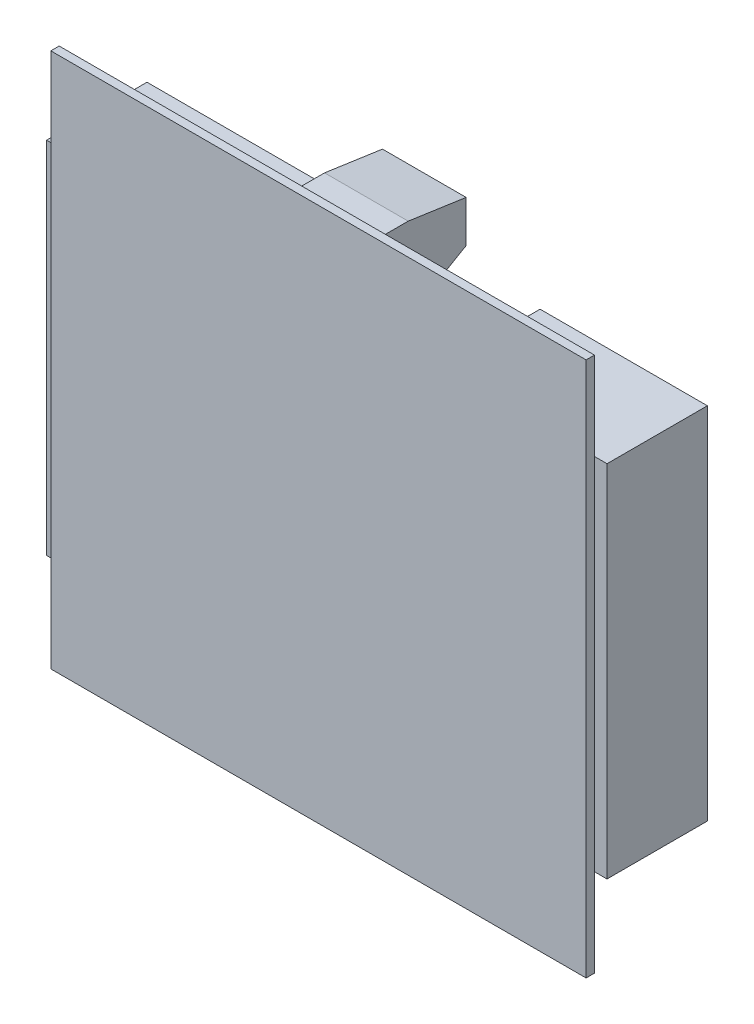
from build123d import *

# Parameters (mm, degrees)
SKETCH2_W           = 64
SKETCH2_H           = 64
BOSS_EXTRUDE1_DEPTH = 1
SKETCH3_W           = 20
SKETCH3_H           = 43
BOSS_EXTRUDE2_DEPTH = 12
BOSS_EXTRUDE3_DEPTH = 10


with BuildPart() as part:
    # Sketch2 → Boss-Extrude1 (new body)
    with BuildSketch(Plane.XY):
        with Locations((32, 32)):
            Rectangle(SKETCH2_W, SKETCH2_H)
    extrude(amount=BOSS_EXTRUDE1_DEPTH)

    # Sketch3 → Boss-Extrude2 (add)
    with BuildSketch(Plane.XY):
        with Locations((8.5, 32)):
            Rectangle(SKETCH3_W, SKETCH3_H)
        with Locations((55.5, 32)):
            Rectangle(SKETCH3_W, SKETCH3_H)
    extrude(amount=-BOSS_EXTRUDE2_DEPTH)

    # Sketch5 → Boss-Extrude3 (add)
    with BuildSketch(Plane(origin=(27, 0, 0), x_dir=(0, 0, -1), z_dir=(1, 0, 0))):
        Polygon((11.654534966, 3.002134122), (4.730028144, 2), (0, 2), (0, 12), (4.730028144, 12), (11.654534966, 8.002134122), align=None)
        Polygon((0, 62), (0, 52), (4.730028144, 52), (11.654534966, 55.997865878), (11.654534966, 60.997865878), (4.730028144, 62), align=None)
    extrude(amount=BOSS_EXTRUDE3_DEPTH)


solid = part.part
